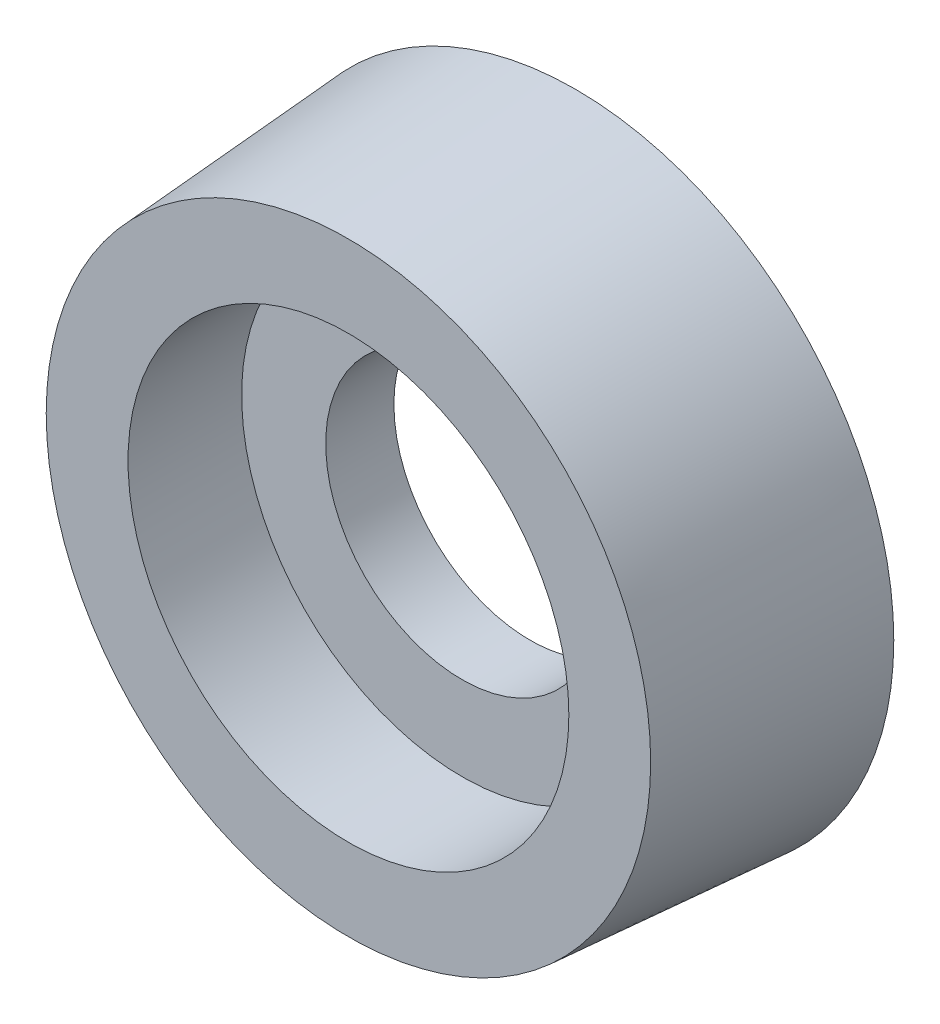
from build123d import *

# Parameters (mm, degrees)
SKETCH_1_R               = 7
EXTRUDE_1_DEPTH          = 5
EXTRUDE_1_TAPER          = 4
SKETCH_3_R               = 5
CUT_EXTRUDE_1_DEPTH      = 1
SKETCH_4_R               = 4.85
CUT_EXTRUDE_2_DEPTH      = 2.5
CUT_EXTRUDE_3_DEPTH      = 11.210288928
CUT_EXTRUDE_3_DEPTH_BACK = 11.210288928
SKETCH_5_R               = 3


with BuildPart() as part:
    # Эскиз1 → Бобышка-Вытянуть1 (new body)
    with BuildSketch(Plane.XY):
        Circle(SKETCH_1_R)
    extrude(amount=EXTRUDE_1_DEPTH, taper=EXTRUDE_1_TAPER)

    # Эскиз3 → Вырез-Вытянуть1 (cut)
    with BuildSketch(Plane(origin=(0, 0, 0), x_dir=(-1, 0, 0), z_dir=(0, 0, -1))):
        Circle(SKETCH_3_R)
    extrude(amount=-CUT_EXTRUDE_1_DEPTH, mode=Mode.SUBTRACT)

    # Эскиз4 → Вырез-Вытянуть2 (cut)
    with BuildSketch(Plane.XY.offset(5)):
        Circle(SKETCH_4_R)
    extrude(amount=-CUT_EXTRUDE_2_DEPTH, mode=Mode.SUBTRACT)

    # Эскиз5 → Вырез-Вытянуть3 (cut, two sides: drawn at the far end of the back side and taken through both)
    with BuildSketch(Plane.XY.offset(2.5).offset(-CUT_EXTRUDE_3_DEPTH_BACK)):
        Circle(SKETCH_5_R)
    extrude(amount=CUT_EXTRUDE_3_DEPTH + CUT_EXTRUDE_3_DEPTH_BACK, mode=Mode.SUBTRACT)


solid = part.part
